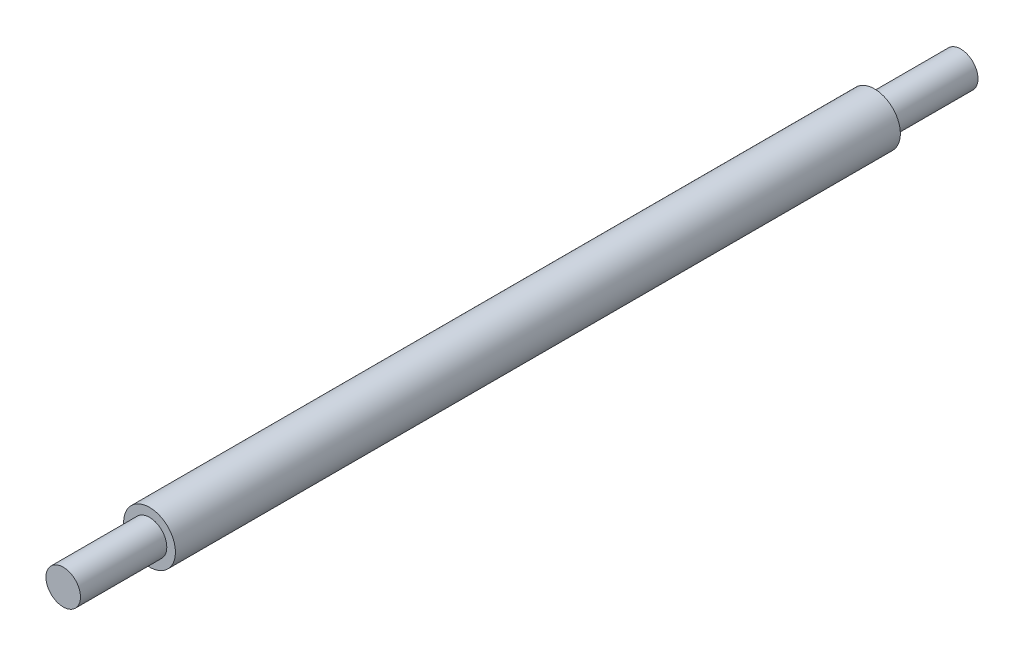
from build123d import *

# Parameters (mm, degrees)
SKETCH1_R           = 3
BOSS_EXTRUDE1_DEPTH = 42
SKETCH2_R           = 2
BOSS_EXTRUDE2_DEPTH = 10


with BuildPart() as part:
    # Sketch1 → Boss-Extrude1 (new, symmetric)
    with BuildSketch(Plane.XY):
        with Locations(Location((0, 0, 0), (0, 0, 180))):
            Circle(SKETCH1_R)
    extrude(amount=BOSS_EXTRUDE1_DEPTH, both=True)

    # Sketch2 → Boss-Extrude2 (add)
    with BuildSketch(Plane.XY.offset(42)):
        Circle(SKETCH2_R)
    boss_extrude2 = extrude(amount=BOSS_EXTRUDE2_DEPTH)

    # Mirror1: Boss-Extrude2 across plane
    add(boss_extrude2.mirror(Plane.XY))


solid = part.part
